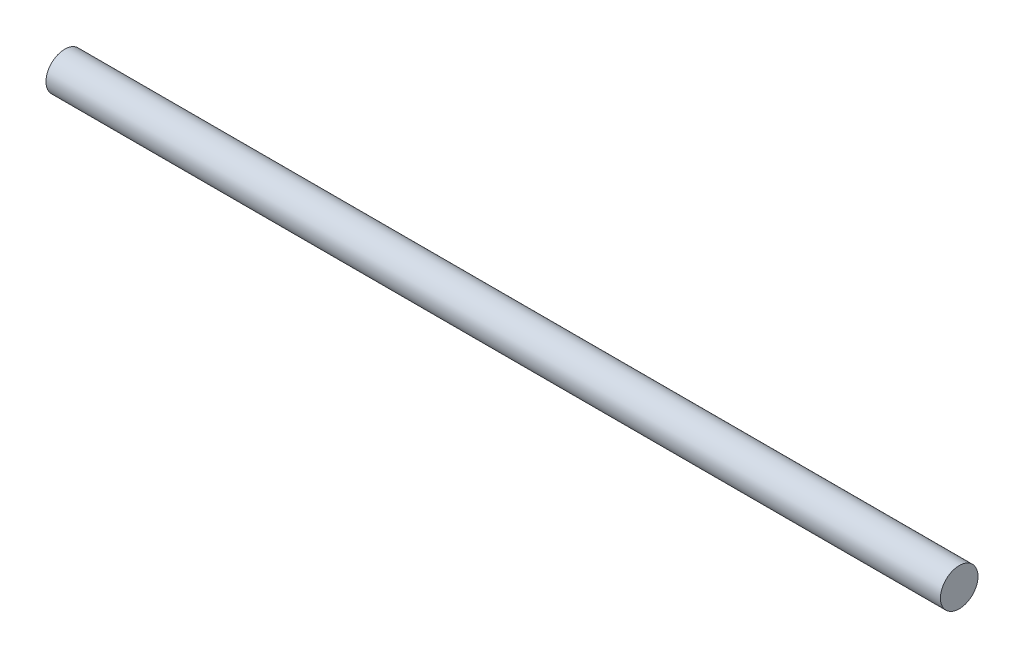
from build123d import *

# Parameters (mm, degrees)
SKETCH1_R           = 4.2
BOSS_EXTRUDE1_DEPTH = 100


with BuildPart() as part:
    # Sketch1 → Boss-Extrude1 (new, symmetric)
    with BuildSketch(Plane(origin=(0, 0, 0), x_dir=(0, 0, -1), z_dir=(1, 0, 0))):
        Circle(SKETCH1_R)
    extrude(amount=BOSS_EXTRUDE1_DEPTH, both=True)


solid = part.part
